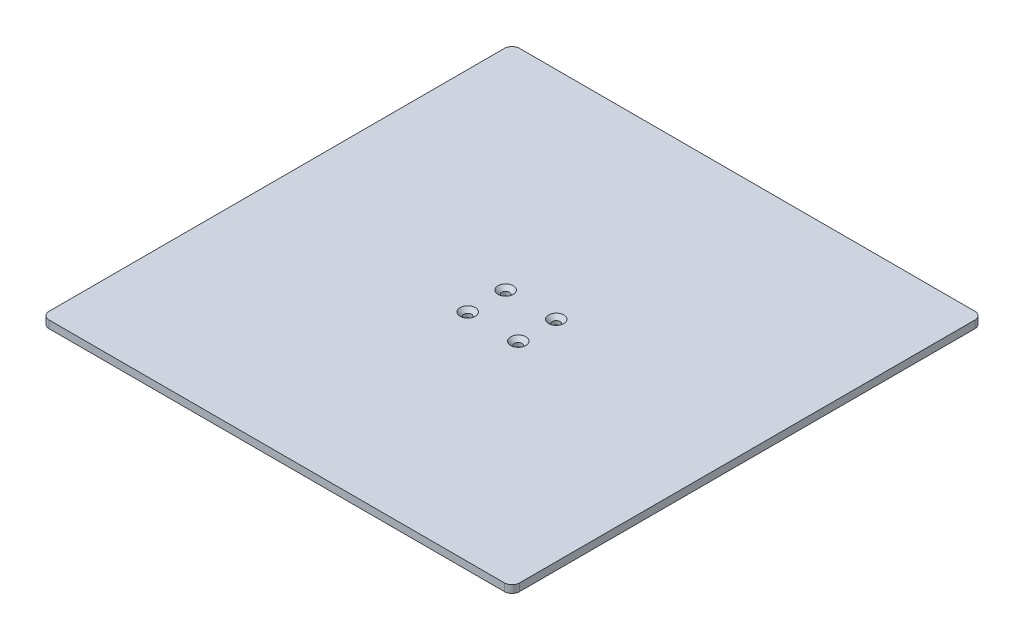
from build123d import *

# Parameters (mm, degrees)
SKETCH1_W           = 186
SKETCH1_H           = 186
BOSS_EXTRUDE1_DEPTH = 3
FILLET1_R           = 3
SKETCH2_R           = 1.5
CUT_EXTRUDE1_DEPTH  = 10
CHAMFER1_SIZE       = 1.5


with BuildPart() as part:
    # Sketch1 → Boss-Extrude1 (new body)
    with BuildSketch(Plane(origin=(0, 0, 0), x_dir=(1, 0, 0), z_dir=(0, 1, 0))):
        Rectangle(SKETCH1_W, SKETCH1_H)
    extrude(amount=-BOSS_EXTRUDE1_DEPTH)

    # Fillet1
    fillet1_edges = [part.edges().sort_by_distance(p)[0] for p in [
        (93, -1.5, 93),
        (-93, -1.5, 93),
        (-93, -1.5, -93),
        (93, -1.5, -93),
    ]]
    fillet(fillet1_edges, radius=FILLET1_R)

    # Sketch2 → Cut-Extrude1 (cut)
    with BuildSketch(Plane(origin=(0, 0, 0), x_dir=(1, 0, 0), z_dir=(0, 1, 0))):
        with Locations(Location((-10, -7.5, 0), (0, 0, 270))):
            Circle(SKETCH2_R)
        with Locations(Location((-10, 7.5, 0), (0, 0, 270))):
            Circle(SKETCH2_R)
        with Locations(Location((10, 7.5, 0), (0, 0, 270))):
            Circle(SKETCH2_R)
        with Locations(Location((10, -7.5, 0), (0, 0, 270))):
            Circle(SKETCH2_R)
    extrude(amount=-CUT_EXTRUDE1_DEPTH, mode=Mode.SUBTRACT)

    # Chamfer1
    chamfer1_edges = [part.edges().sort_by_distance(p)[0] for p in [
        (-10, 0, 6),
        (-10, 0, -9),
        (10, 0, -9),
        (10, 0, 6),
    ]]
    chamfer(chamfer1_edges, length=CHAMFER1_SIZE)


solid = part.part
